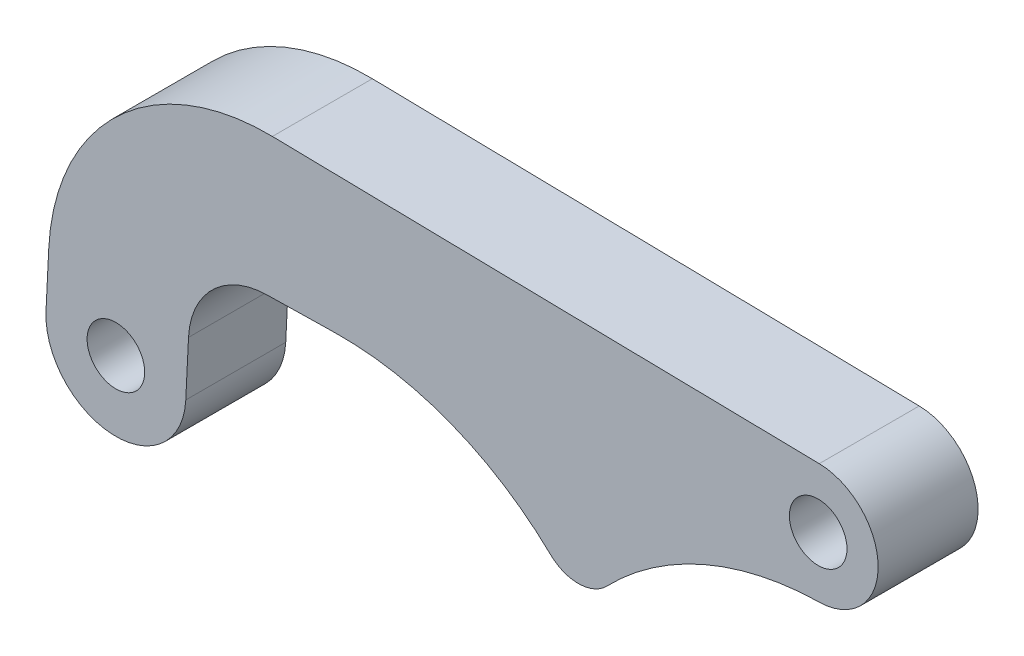
from build123d import *

# Parameters (mm, degrees)
SKETCH1_R           = 2.286
BOSS_EXTRUDE1_DEPTH = 3.96875


with BuildPart() as part:
    # Sketch1 → Boss-Extrude1 (new, symmetric)
    with BuildSketch(Plane.XY):
        with BuildLine():
            Line((55.852160303, 20.499543888), (12.426339018, 21.289226167))
            ThreePointArc((12.426339018, 21.289226167), (0.183355577, 16.585853064), (-5.332604413, 4.686838505))
            Line((-5.332604413, 4.686838505), (-5.549551288, 0.272753664))
            ThreePointArc((-5.549551288, 0.272753664), (-0.272753664, -5.549551288), (5.549551288, -0.272753664))
            Line((5.549551288, -0.272753664), (5.766498164, 4.141331178))
            ThreePointArc((5.766498164, 4.141331178), (7.688680768, 8.388633469), (11.993389211, 10.178563055))
            Line((11.993389211, 10.178563055), (17.405800458, 10.276985724))
            ThreePointArc((17.405800458, 10.276985724), (26.626022332, 8.622204767), (34.517045693, 3.574181217))
            ThreePointArc((34.517045693, 3.574181217), (36.773296982, 2.690364107), (38.995923428, 3.65562793))
            ThreePointArc((38.995923428, 3.65562793), (46.698197557, 8.987209748), (55.852160303, 10.976118364))
            ThreePointArc((55.852160303, 10.976118364), (60.528070342, 15.737831126), (55.852160303, 20.499543888))
        make_face()
        Circle(SKETCH1_R, mode=Mode.SUBTRACT)
        with Locations((55.765570342, 15.737831126)):
            Circle(SKETCH1_R, mode=Mode.SUBTRACT)
    extrude(amount=BOSS_EXTRUDE1_DEPTH, both=True)


solid = part.part
